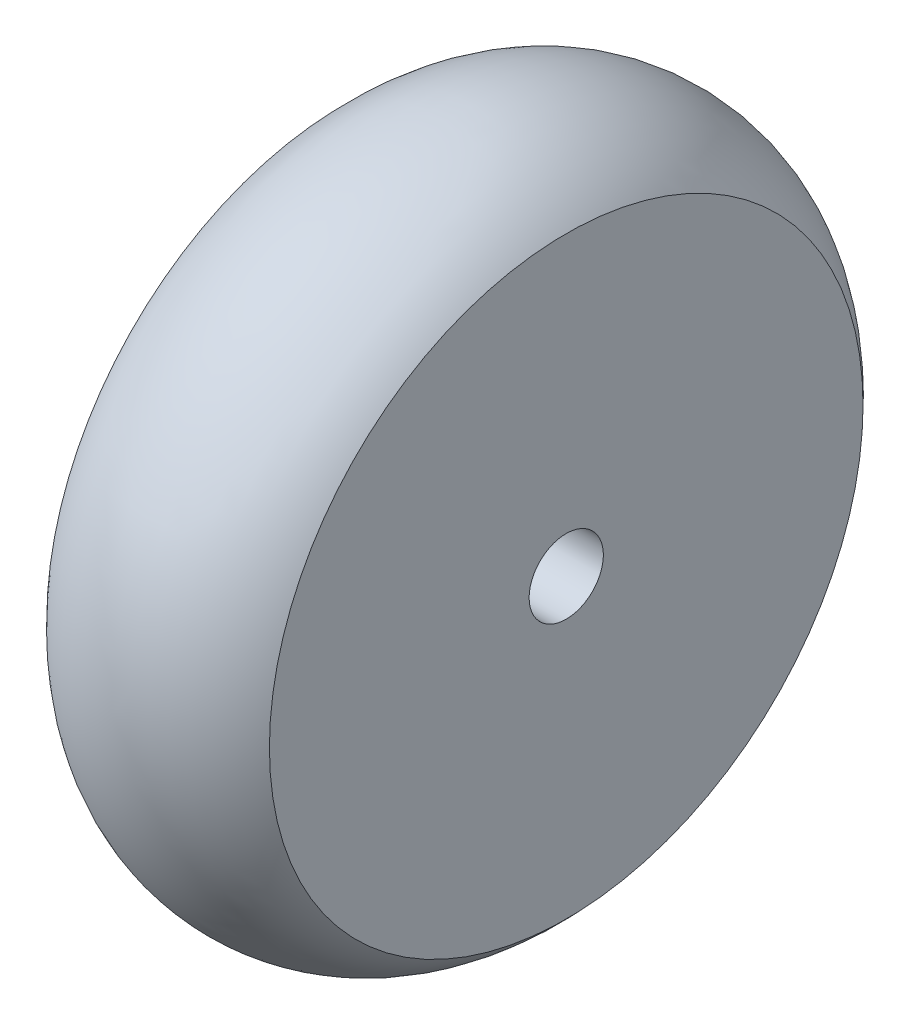
from build123d import *

# Parameters (mm, degrees)
SKETCH_2_R          = 2.5
CUT_EXTRUDE_1_DEPTH = 73.943163699


with BuildPart() as part:
    # 草圖1 → 旋轉1 (revolve)
    with BuildSketch(Plane.XY, mode=Mode.PRIVATE) as revolve_1_sk:
        with BuildLine():
            Line((-16.610358734, 44.059302541), (-16.610358734, 64.059302541))
            ThreePointArc((-16.610358734, 64.059302541), (-9.110358734, 67.444924263), (-1.610358734, 64.059302541))
            Line((-1.610358734, 64.059302541), (-1.610358734, 44.059302541))
            Line((-1.610358734, 44.059302541), (-16.610358734, 44.059302541))
        make_face()
    revolve(revolve_1_sk.sketch.rotate(Axis((-1.610358734, 44.059302541, 0), (-1, 0, 0)), 90), axis=Axis((-1.610358734, 44.059302541, 0), (-1, 0, 0)))

    # 草圖2 → 除料-伸長1 (cut, through all)
    with BuildSketch(Plane.ZY.offset(16.610358734)):
        with Locations((0, 44.059302541)):
            Circle(SKETCH_2_R)
    extrude(amount=-CUT_EXTRUDE_1_DEPTH, mode=Mode.SUBTRACT)


solid = part.part
